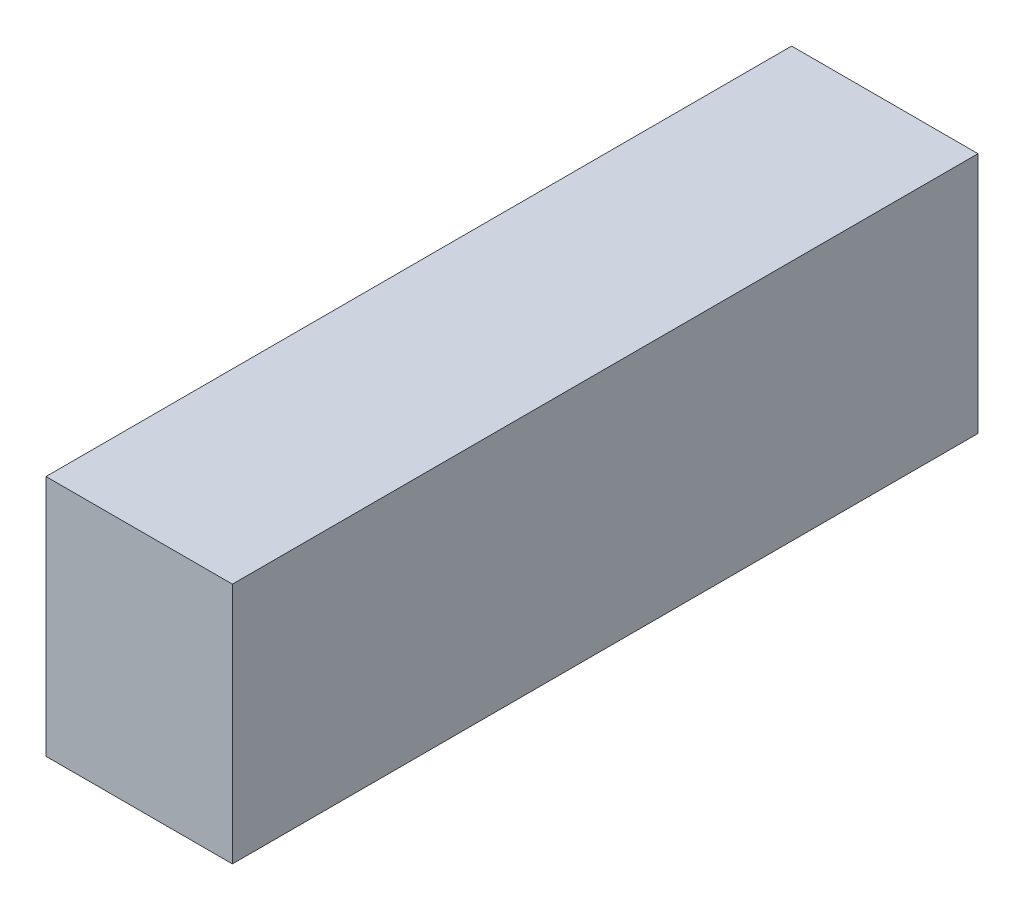
from build123d import *

# Parameters (mm, degrees)
SKETCH1_W           = 40
SKETCH1_H           = 13
BOSS_EXTRUDE1_DEPTH = 10


with BuildPart() as part:
    # Sketch1 → Boss-Extrude1 (new body)
    with BuildSketch(Plane(origin=(0, 0, 0), x_dir=(0, 0, -1), z_dir=(1, 0, 0))):
        with Locations((20, 6.5)):
            Rectangle(SKETCH1_W, SKETCH1_H)
    extrude(amount=BOSS_EXTRUDE1_DEPTH)


solid = part.part
